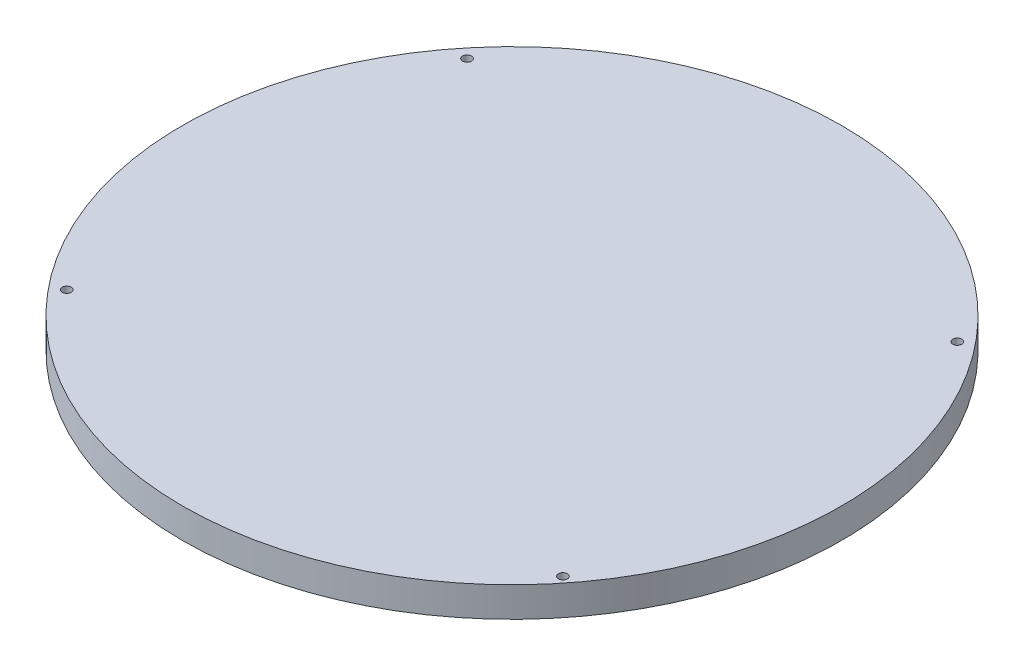
from build123d import *

# Parameters (mm, degrees)
SKETCH_1_R      = 110
SKETCH_1_R_2    = 1.5
EXTRUDE_1_DEPTH = 10


with BuildPart() as part:
    # 草图1 → 凸台-拉伸1 (new body)
    with BuildSketch(Plane(origin=(0, 0, 0), x_dir=(1, 0, 0), z_dir=(0, 1, 0))):
        with Locations(Location((0, 0, 0), (0, 0, 270))):
            Circle(SKETCH_1_R)
        with Locations(Location((-81.819805153, -66.819805153, 0), (0, 0, 270))):
            Circle(SKETCH_1_R_2, mode=Mode.SUBTRACT)
        with Locations(Location((83.819805153, -66.819805153, 0), (0, 0, 270))):
            Circle(SKETCH_1_R_2, mode=Mode.SUBTRACT)
        with Locations(Location((-81.819805153, 66.819805153, 0), (0, 0, 270))):
            Circle(SKETCH_1_R_2, mode=Mode.SUBTRACT)
        with Locations(Location((81.819805153, 66.819805153, 0), (0, 0, 270))):
            Circle(SKETCH_1_R_2, mode=Mode.SUBTRACT)
    extrude(amount=EXTRUDE_1_DEPTH)


solid = part.part
